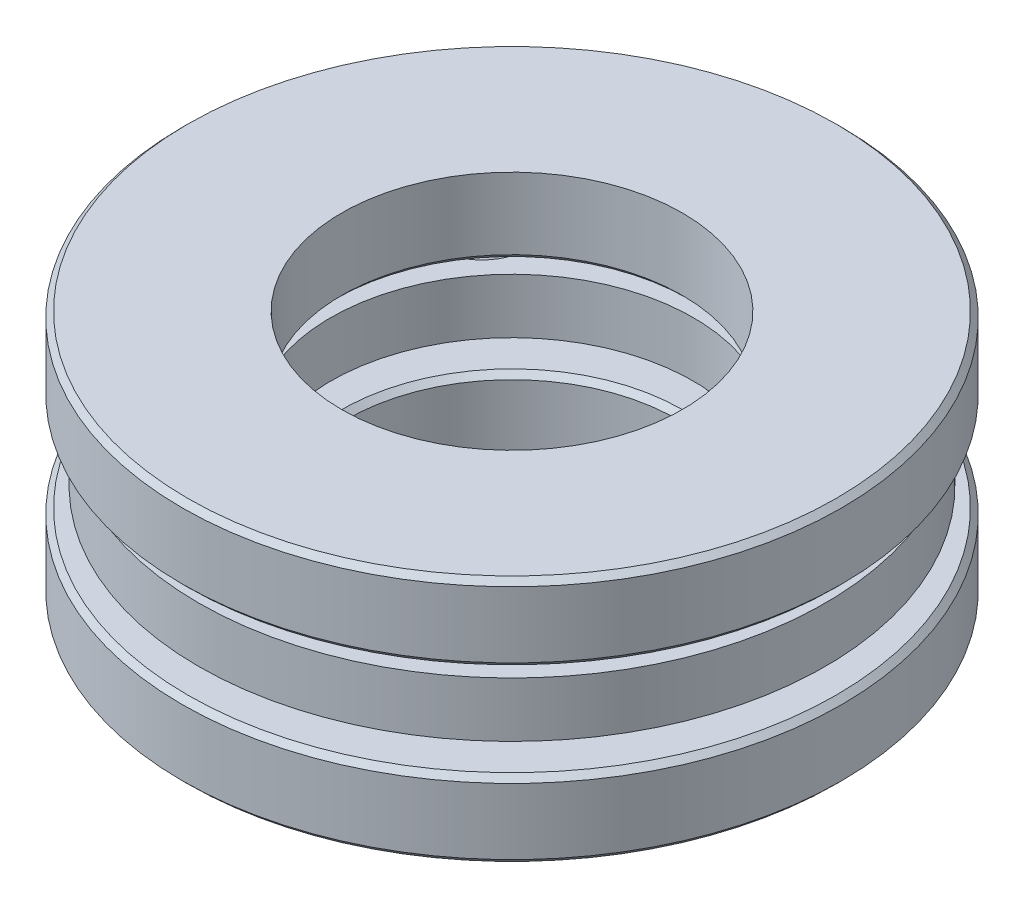
from build123d import *

# Parameters (mm, degrees)
SKETCH1_R           = 6
SKETCH1_R_2         = 3
BOSS_EXTRUDE1_DEPTH = 1.4
BOSS_EXTRUDE2_START = -1.4
SKETCH3_R           = 6
SKETCH3_R_2         = 3.1
BOSS_EXTRUDE2_DEPTH = 1.4
SKETCH5_R           = 5.7
SKETCH5_R_2         = 3.3
BOSS_EXTRUDE4_DEPTH = 0.5
CIRPATTERN2_COUNT   = 9
CIRPATTERN2_2_COUNT = 9
CHAMFER1_SIZE       = 0.1


with BuildPart() as part:
    # Sketch1 → Boss-Extrude1 (new body)
    with BuildSketch(Plane(origin=(0, 0, 0), x_dir=(1, 0, 0), z_dir=(0, 1, 0))):
        Circle(SKETCH1_R)
        Circle(SKETCH1_R_2, mode=Mode.SUBTRACT)
    extrude(amount=BOSS_EXTRUDE1_DEPTH)


with BuildPart() as body_2:
    # Sketch3 → Boss-Extrude2 (new body)
    with BuildSketch(Plane(origin=(0, 4.5, 0), x_dir=(1, 0, 0), z_dir=(0, 1, 0)).offset(BOSS_EXTRUDE2_START)):
        Circle(SKETCH3_R)
        Circle(SKETCH3_R_2, mode=Mode.SUBTRACT)
    extrude(amount=BOSS_EXTRUDE2_DEPTH)


with BuildPart() as body_3:
    # Sketch5 → Boss-Extrude4 (new, symmetric)
    with BuildSketch(Plane(origin=(0, 2.25, 0), x_dir=(1, 0, 0), z_dir=(0, 1, 0))):
        Circle(SKETCH5_R)
        Circle(SKETCH5_R_2, mode=Mode.SUBTRACT)
    extrude(amount=BOSS_EXTRUDE4_DEPTH, both=True)


with BuildPart() as cut_revolve1_tool:
    # Sketch2 → Cut-Revolve1 (revolve)
    with BuildSketch(Plane(origin=(0, 2.25, 0), x_dir=(1, 0, 0), z_dir=(0, 1, 0))):
        with BuildLine():
            Line((-4.5, 1), (-4.5, -1))
            ThreePointArc((-4.5, -1), (-5.5, 0), (-4.5, 1))
        make_face()
    cut_revolve1 = revolve(axis=Axis((-4.5, 2.25, -1), (0, 0, 1)))


with BuildPart() as part_1:
    add(part.part)

    # Cut-Revolve1: cut by cut_revolve1_tool
    add(cut_revolve1_tool.part, mode=Mode.SUBTRACT)

    # Sketch2<3> → Revolve1 (revolve)
    with BuildSketch(Plane(origin=(0, 2.25, 0), x_dir=(1, 0, 0), z_dir=(0, 1, 0))):
        with BuildLine():
            Line((-4.5, 1), (-4.5, -1))
            ThreePointArc((-4.5, -1), (-5.5, 0), (-4.5, 1))
        make_face()
    revolve1 = revolve(axis=Axis((-4.5, 2.25, -1), (0, 0, 1)))


with BuildPart() as body_2_1:
    add(body_2.part)

    # Cut-Revolve1: cut by cut_revolve1_tool
    add(cut_revolve1_tool.part, mode=Mode.SUBTRACT)


with BuildPart() as body_3_1:
    add(body_3.part)

    # Cut-Revolve1: cut by cut_revolve1_tool
    add(cut_revolve1_tool.part, mode=Mode.SUBTRACT)


with BuildPart() as cirpattern2_tool:
    # CirPattern2: Cut-Revolve1 ×9 about axis
    cirpattern2_axis = Axis((0, 1.4, 0), (0, -1, 0))
    for i in range(1, CIRPATTERN2_COUNT):
        add(cut_revolve1.rotate(cirpattern2_axis, i * 360 / CIRPATTERN2_COUNT))


with BuildPart() as part_2:
    add(part_1.part)

    # CirPattern2: cut by cirpattern2_tool
    add(cirpattern2_tool.part, mode=Mode.SUBTRACT)



with BuildPart() as body_2_2:
    add(body_2_1.part)

    # CirPattern2: cut by cirpattern2_tool
    add(cirpattern2_tool.part, mode=Mode.SUBTRACT)


with BuildPart() as body_3_2:
    add(body_3_1.part)

    # CirPattern2: cut by cirpattern2_tool
    add(cirpattern2_tool.part, mode=Mode.SUBTRACT)


with BuildPart() as part_3:
    add(part_2.part)

    add(body_2_2.part)  # CirPattern2 2 merges body 2

    add(body_3_2.part)  # CirPattern2 2 merges body 3
    # CirPattern2 2: Revolve1 ×9 about axis
    cirpattern2_2_axis = Axis((0, 1.4, 0), (0, -1, 0))
    for i in range(1, CIRPATTERN2_2_COUNT):
        add(revolve1.rotate(cirpattern2_2_axis, i * 360 / CIRPATTERN2_2_COUNT))

    # Chamfer1
    chamfer1_edges = [part_3.edges().sort_by_distance(p)[0] for p in [
        (-3, 1.4, 0),
        (-3.1, 3.1, 0),
        (-6, 1.4, 0),
        (-6, 3.1, 0),
        (-6, 0, 0),
        (-6, 4.5, 0),
    ]]
    chamfer(chamfer1_edges, length=CHAMFER1_SIZE)


solid = part_3.part
